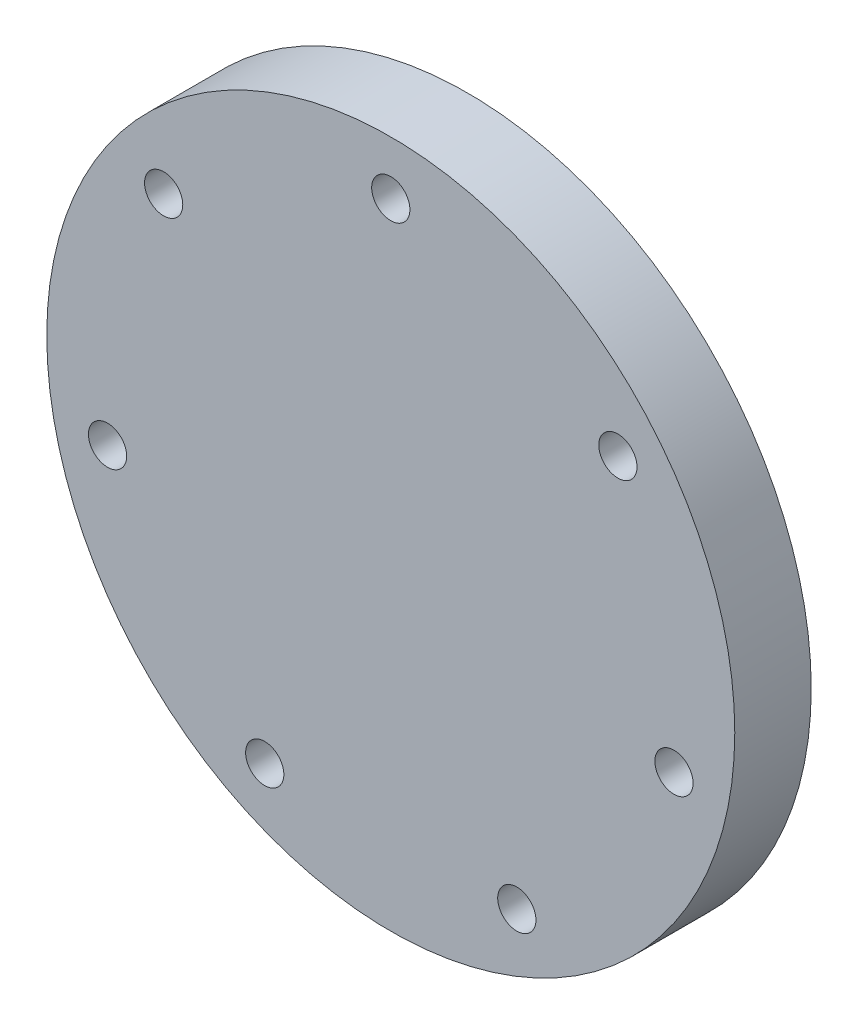
from build123d import *

# Parameters (mm, degrees)
SKETCH1_R           = 22.5
SKETCH1_R_2         = 1.25
BOSS_EXTRUDE1_DEPTH = 5


with BuildPart() as part:
    # Sketch1 → Boss-Extrude1 (new body)
    with BuildSketch(Plane.XY):
        Circle(SKETCH1_R)
        with Locations((0, 19)):
            Circle(SKETCH1_R_2, mode=Mode.SUBTRACT)
        with Locations((14.854798167, 11.846306235)):
            Circle(SKETCH1_R_2, mode=Mode.SUBTRACT)
        with Locations((18.523630331, -4.227897745)):
            Circle(SKETCH1_R_2, mode=Mode.SUBTRACT)
        with Locations((8.243791043, -17.11840849)):
            Circle(SKETCH1_R_2, mode=Mode.SUBTRACT)
        with Locations((-8.243791043, -17.11840849)):
            Circle(SKETCH1_R_2, mode=Mode.SUBTRACT)
        with Locations((-18.523630331, -4.227897745)):
            Circle(SKETCH1_R_2, mode=Mode.SUBTRACT)
        with Locations((-14.854798167, 11.846306235)):
            Circle(SKETCH1_R_2, mode=Mode.SUBTRACT)
    extrude(amount=BOSS_EXTRUDE1_DEPTH)


solid = part.part
